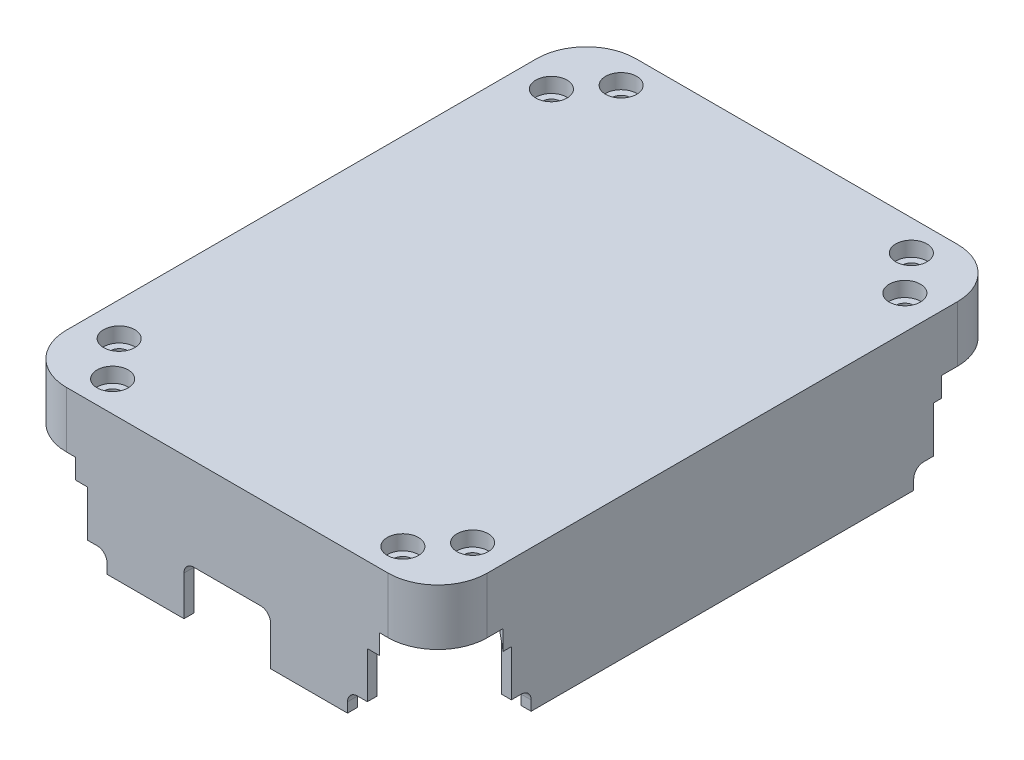
from build123d import *

# Parameters (mm, degrees)
SKETCH1_W               = 107.95
SKETCH1_H               = 146.05
BOSS_EXTRUDE1_DEPTH     = 2.54
SKETCH13_W              = 25.4
SKETCH13_H              = 25.4
BOSS_EXTRUDE4_DEPTH     = 19.431
SKETCH2_R               = 3.302
CUT_EXTRUDE1_DEPTH      = 93.862882849
FILLET1_R               = 12.7
CUT_EXTRUDE13_DEPTH     = 5.08
SKETCH15_R              = 5.08
BOSS_EXTRUDE5_DEPTH     = 11.811
SKETCH23_R              = 2.25
CUT_EXTRUDE14_DEPTH     = 92.934228941
SKETCH24_R              = 4
CUT_EXTRUDE15_DEPTH     = 3.81
MIRROR2_COPY_1_SKETCH_R = 2.25
MIRROR2_COPY_1_DEPTH    = 92.934228941
MIRROR2_COPY_2_SKETCH_R = 4
MIRROR2_COPY_2_DEPTH    = 3.81
FILLET3_R               = 12.7
FILLET4_R               = 1.016
SKETCH27_W              = 71.841582164
SKETCH27_H              = 2.54
SKETCH27_W_2            = 2.54
SKETCH27_H_2            = 108.293882364
BOSS_EXTRUDE6_DEPTH     = 33.782
CUT_EXTRUDE16_DEPTH     = 41.656
CUT_EXTRUDE17_DEPTH     = 136.296492227
CUT_EXTRUDE18_DEPTH     = 160.8849299
CUT_EXTRUDE19_REACH     = 161.885
SKETCH31_W              = 22.225
SKETCH31_H              = 12.7
FILLET5_R               = 2.54


with BuildPart() as part:
    # Sketch1 → Boss-Extrude1 (new body)
    with BuildSketch(Plane(origin=(0, 0, 0), x_dir=(1, 0, 0), z_dir=(0, 1, 0))):
        Rectangle(SKETCH1_W, SKETCH1_H)
    extrude(amount=-BOSS_EXTRUDE1_DEPTH)

    # Sketch13 → Boss-Extrude4 (add)
    with BuildSketch(Plane(origin=(0, 0, 0), x_dir=(1, 0, 0), z_dir=(0, 1, 0))):
        with Locations((41.275, -60.325)):
            Rectangle(SKETCH13_W, SKETCH13_H)
        with Locations((-41.275, -60.325)):
            Rectangle(SKETCH13_W, SKETCH13_H)
        with Locations((-41.275, 60.325)):
            Rectangle(SKETCH13_W, SKETCH13_H)
        with Locations((41.275, 60.325)):
            Rectangle(SKETCH13_W, SKETCH13_H)
    extrude(amount=-BOSS_EXTRUDE4_DEPTH)

    # Sketch2 → Cut-Extrude1 (cut, through all)
    with BuildSketch(Plane(origin=(0, 0, 0), x_dir=(1, 0, 0), z_dir=(0, 1, 0))):
        with Locations(Location((45.326413441, 55.435363088, 0), (0, 0, 90))):
            Circle(SKETCH2_R)
        with Locations(Location((37.223586559, 65.214636912, 0), (0, 0, 90))):
            Circle(SKETCH2_R)
        with Locations(Location((45.326413441, -55.435363088, 0), (0, 0, 270))):
            Circle(SKETCH2_R)
        with Locations(Location((37.223586559, -65.214636912, 0), (0, 0, 270))):
            Circle(SKETCH2_R)
        with Locations(Location((-37.223586559, 65.214636912, 0), (0, 0, 270))):
            Circle(SKETCH2_R)
        with Locations(Location((-45.326413441, 55.435363088, 0), (0, 0, 270))):
            Circle(SKETCH2_R)
        with Locations(Location((-45.326413441, -55.435363088, 0), (0, 0, 90))):
            Circle(SKETCH2_R)
        with Locations(Location((-37.223586559, -65.214636912, 0), (0, 0, 90))):
            Circle(SKETCH2_R)
    extrude(amount=-CUT_EXTRUDE1_DEPTH, mode=Mode.SUBTRACT)

    # Fillet1
    fillet1_edges = [part.edges().sort_by_distance(p)[0] for p in [
        (53.975, -9.7155, 73.025),
        (-53.975, -9.7155, 73.025),
        (-53.975, -9.7155, -73.025),
        (53.975, -9.7155, -73.025),
    ]]
    fillet(fillet1_edges, radius=FILLET1_R)

    # Sketch14 → Cut-Extrude13 (cut)
    with BuildSketch(Plane.XZ.offset(19.431)):
        Polygon((20.692003582, -28.674172721), (6.35, -45.983487389), (139.038226295, -155.925160605), (153.380229877, -138.615845937), align=None)
        Polygon((-20.692003582, -28.674172721), (-6.35, -45.983487389), (-139.038226295, -155.925160605), (-153.380229877, -138.615845937), align=None)
        Polygon((-153.380229877, 138.615845937), (-20.692003582, 28.674172721), (-6.35, 45.983487389), (-139.038226295, 155.925160605), align=None)
        Polygon((20.692003582, 28.674172721), (6.35, 45.983487389), (139.038226295, 155.925160605), (153.380229877, 138.615845937), align=None)
    extrude(amount=-CUT_EXTRUDE13_DEPTH, mode=Mode.SUBTRACT)

    # Sketch15 → Boss-Extrude5 (add)
    with BuildSketch(Plane(origin=(0, 0, 0), x_dir=(1, 0, 0), z_dir=(0, 1, 0))):
        with Locations((-45.326413441, 55.435363088)):
            Circle(SKETCH15_R)
        with Locations((45.326413441, 55.435363088)):
            Circle(SKETCH15_R)
        with Locations((37.223586559, 65.214636912)):
            Circle(SKETCH15_R)
        with Locations((45.326413441, -55.435363088)):
            Circle(SKETCH15_R)
        with Locations((37.223586559, -65.214636912)):
            Circle(SKETCH15_R)
        with Locations((-37.223586559, -65.214636912)):
            Circle(SKETCH15_R)
        with Locations((-37.223586559, 65.214636912)):
            Circle(SKETCH15_R)
        with Locations((-45.326413441, -55.435363088)):
            Circle(SKETCH15_R)
    extrude(amount=-BOSS_EXTRUDE5_DEPTH)

    # Sketch23 → Cut-Extrude14 (cut, through all)
    with BuildSketch(Plane.XZ.offset(14.351)):
        with Locations(Location((-45.326413441, -55.435363088, 0), (0, 0, 270))):
            Circle(SKETCH23_R)
        with Locations(Location((-37.223586559, -65.214636912, 0), (0, 0, 270))):
            Circle(SKETCH23_R)
    cut_extrude14 = extrude(amount=-CUT_EXTRUDE14_DEPTH, mode=Mode.SUBTRACT)

    # Sketch24 → Cut-Extrude15 (cut)
    with BuildSketch(Plane(origin=(0, 0, 0), x_dir=(1, 0, 0), z_dir=(0, 1, 0))):
        with Locations(Location((-45.326413441, 55.435363088, 0), (0, 0, 270))):
            Circle(SKETCH24_R)
        with Locations(Location((-37.223586559, 65.214636912, 0), (0, 0, 270))):
            Circle(SKETCH24_R)
    cut_extrude15 = extrude(amount=-CUT_EXTRUDE15_DEPTH, mode=Mode.SUBTRACT)

    # Mirror1: Cut-Extrude14, Cut-Extrude15 across plane
    add(cut_extrude14.mirror(Plane.XY), mode=Mode.SUBTRACT)
    add(cut_extrude15.mirror(Plane.XY), mode=Mode.SUBTRACT)

    # Mirror2: Cut-Extrude14, Cut-Extrude15 across plane
    add(cut_extrude14.mirror(Plane(origin=(0, 0, 0), x_dir=(0, 0, 1), z_dir=(1, 0, 0))), mode=Mode.SUBTRACT)
    add(cut_extrude15.mirror(Plane(origin=(0, 0, 0), x_dir=(0, 0, 1), z_dir=(1, 0, 0))), mode=Mode.SUBTRACT)

    # Mirror2 copy 1 sketch → Mirror2 copy 1 (cut, through all)
    with BuildSketch(Plane(origin=(0, -14.351, 0), x_dir=(-1, 0, 0), z_dir=(0, -1, 0))):
        with Locations(Location((-45.326413441, -55.435363088, 0), (0, 0, 270))):
            Circle(MIRROR2_COPY_1_SKETCH_R)
        with Locations(Location((-37.223586559, -65.214636912, 0), (0, 0, 270))):
            Circle(MIRROR2_COPY_1_SKETCH_R)
    extrude(amount=-MIRROR2_COPY_1_DEPTH, mode=Mode.SUBTRACT)

    # Mirror2 copy 2 sketch → Mirror2 copy 2 (cut)
    with BuildSketch(Plane(origin=(0, 0, 0), x_dir=(-1, 0, 0), z_dir=(0, 1, 0))):
        with Locations(Location((-45.326413441, 55.435363088, 0), (0, 0, 270))):
            Circle(MIRROR2_COPY_2_SKETCH_R)
        with Locations(Location((-37.223586559, 65.214636912, 0), (0, 0, 270))):
            Circle(MIRROR2_COPY_2_SKETCH_R)
    extrude(amount=-MIRROR2_COPY_2_DEPTH, mode=Mode.SUBTRACT)

    # Fillet3
    fillet3_edges = [part.edges().sort_by_distance(p)[0] for p in [
        (28.575, -8.4455, -47.625),
        (-28.575, -8.4455, -47.625),
        (-28.575, -8.4455, 47.625),
        (28.575, -8.4455, 47.625),
    ]]
    fillet(fillet3_edges, radius=FILLET3_R)

    # Fillet4
    fillet4_edges = [part.edges().sort_by_distance(p)[0] for p in [
        (45.326413441, -14.351, -52.133363088),
        (37.223586559, -14.351, -61.912636912),
        (-45.326413441, -14.351, -58.737363088),
        (-37.223586559, -14.351, -68.516636912),
        (-45.326413441, -14.351, 58.737363088),
        (-37.223586559, -14.351, 68.516636912),
        (37.223586559, -14.351, 61.912636912),
        (45.326413441, -14.351, 52.133363088),
    ]]
    fillet(fillet4_edges, radius=FILLET4_R)

    # Sketch27 → Boss-Extrude6 (add)
    with BuildSketch(Plane.XZ.offset(2.54)):
        with Locations((0, -71.755)):
            Rectangle(SKETCH27_W, SKETCH27_H)
        with Locations((0, 71.755)):
            Rectangle(SKETCH27_W, SKETCH27_H)
        with Locations((52.705, 0)):
            Rectangle(SKETCH27_W_2, SKETCH27_H_2)
        with Locations((-52.705, 0)):
            Rectangle(SKETCH27_W_2, SKETCH27_H_2)
    extrude(amount=BOSS_EXTRUDE6_DEPTH)

    # Sketch28 → Cut-Extrude16 (cut)
    with BuildSketch(Plane(origin=(0, 0, -73.025), x_dir=(-1, 0, 0), z_dir=(0, 0, -1))):
        with BuildLine():
            Line((-17.526, -36.322), (17.526, -36.322))
            Line((17.526, -36.322), (29.591, -36.322))
            Line((29.591, -36.322), (29.591, -33.782))
            ThreePointArc((29.591, -33.782), (28.847051224, -31.985948776), (27.051, -31.242))
            Line((27.051, -31.242), (19.431, -31.242))
            ThreePointArc((19.431, -31.242), (17.634948776, -30.498051224), (16.891, -28.702))
            Line((16.891, -28.702), (16.891, -21.3995))
            ThreePointArc((16.891, -21.3995), (16.147051224, -19.603448776), (14.351, -18.8595))
            Line((14.351, -18.8595), (-14.351, -18.8595))
            ThreePointArc((-14.351, -18.8595), (-16.147051224, -19.603448776), (-16.891, -21.3995))
            Line((-16.891, -21.3995), (-16.891, -28.702))
            ThreePointArc((-16.891, -28.702), (-17.634948776, -30.498051224), (-19.431, -31.242))
            Line((-19.431, -31.242), (-27.051, -31.242))
            ThreePointArc((-27.051, -31.242), (-28.847051224, -31.985948776), (-29.591, -33.782))
            Line((-29.591, -33.782), (-29.591, -36.322))
            Line((-29.591, -36.322), (-17.526, -36.322))
        make_face()
    extrude(amount=-CUT_EXTRUDE16_DEPTH, mode=Mode.SUBTRACT)

    # Sketch29 → Cut-Extrude17 (cut, through all)
    with BuildSketch(Plane.ZY.offset(53.975)):
        with BuildLine():
            Line((-54.146941182, -36.322), (-49.066941182, -36.322))
            Line((-49.066941182, -36.322), (-49.066941182, -33.782))
            ThreePointArc((-49.066941182, -33.782), (-49.810889958, -31.985948776), (-51.606941182, -31.242))
            Line((-51.606941182, -31.242), (-54.146941182, -31.242))
            Line((-54.146941182, -31.242), (-54.146941182, -36.322))
        make_face()
        with BuildLine():
            Line((49.066941182, -36.322), (49.066941182, -33.782))
            ThreePointArc((49.066941182, -33.782), (49.810889958, -31.985948776), (51.606941182, -31.242))
            Line((51.606941182, -31.242), (54.146941182, -31.242))
            Line((54.146941182, -31.242), (54.146941182, -36.322))
            Line((54.146941182, -36.322), (49.066941182, -36.322))
        make_face()
    extrude(amount=-CUT_EXTRUDE17_DEPTH, mode=Mode.SUBTRACT)

    # Sketch30 → Cut-Extrude18 (cut, through all)
    with BuildSketch(Plane.XY.offset(73.025)):
        with BuildLine():
            Line((-35.920791082, -36.322), (-30.840791082, -36.322))
            Line((-30.840791082, -36.322), (-30.840791082, -33.782))
            ThreePointArc((-30.840791082, -33.782), (-31.584739858, -31.985948776), (-33.380791082, -31.242))
            Line((-33.380791082, -31.242), (-35.920791082, -31.242))
            Line((-35.920791082, -31.242), (-35.920791082, -36.322))
        make_face()
        with BuildLine():
            Line((30.840791082, -36.322), (30.840791082, -33.782))
            ThreePointArc((30.840791082, -33.782), (31.584739858, -31.985948776), (33.380791082, -31.242))
            Line((33.380791082, -31.242), (35.920791082, -31.242))
            Line((35.920791082, -31.242), (35.920791082, -36.322))
            Line((35.920791082, -36.322), (30.840791082, -36.322))
        make_face()
    extrude(amount=-CUT_EXTRUDE18_DEPTH, mode=Mode.SUBTRACT)

    # Sketch31 → Cut-Extrude19 (cut, up to next)
    with BuildSketch(Plane.XY.offset(73.025), mode=Mode.PRIVATE) as cut_extrude19_sk1:
        with Locations((0, -29.972)):
            Rectangle(SKETCH31_W, SKETCH31_H)
    cut_extrude19_tool1 = extrude(cut_extrude19_sk1.sketch, amount=-CUT_EXTRUDE19_REACH, mode=Mode.PRIVATE) & part.part
    add(cut_extrude19_tool1.solids().sort_by_distance((0, -29.972, 73.025))[0], mode=Mode.SUBTRACT)

    # Fillet5
    fillet5_edges = [part.edges().sort_by_distance(p)[0] for p in [
        (-11.1125, -23.622, 71.755),
        (11.1125, -23.622, 71.755),
    ]]
    fillet(fillet5_edges, radius=FILLET5_R)


solid = part.part
